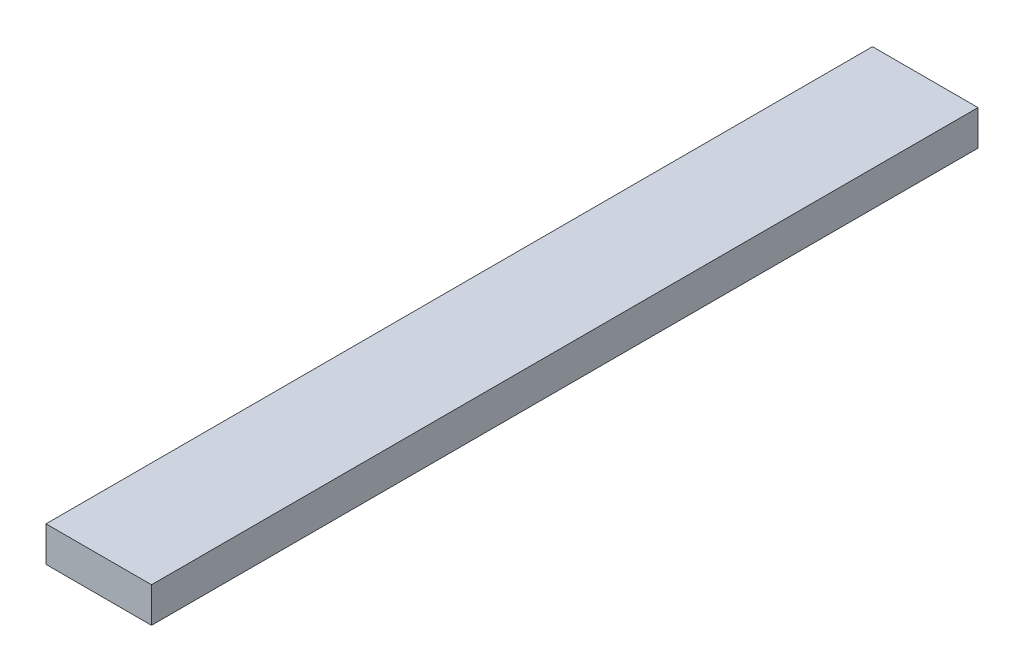
from build123d import *

# Parameters (mm, degrees)
SKETCH_1_W      = 60
SKETCH_1_H      = 20
EXTRUDE_1_DEPTH = 470


with BuildPart() as part:
    # Эскиз1 → Бобышка-Вытянуть1 (new body)
    with BuildSketch(Plane.XY):
        with Locations((30, 10)):
            Rectangle(SKETCH_1_W, SKETCH_1_H)
    extrude(amount=-EXTRUDE_1_DEPTH)


solid = part.part
